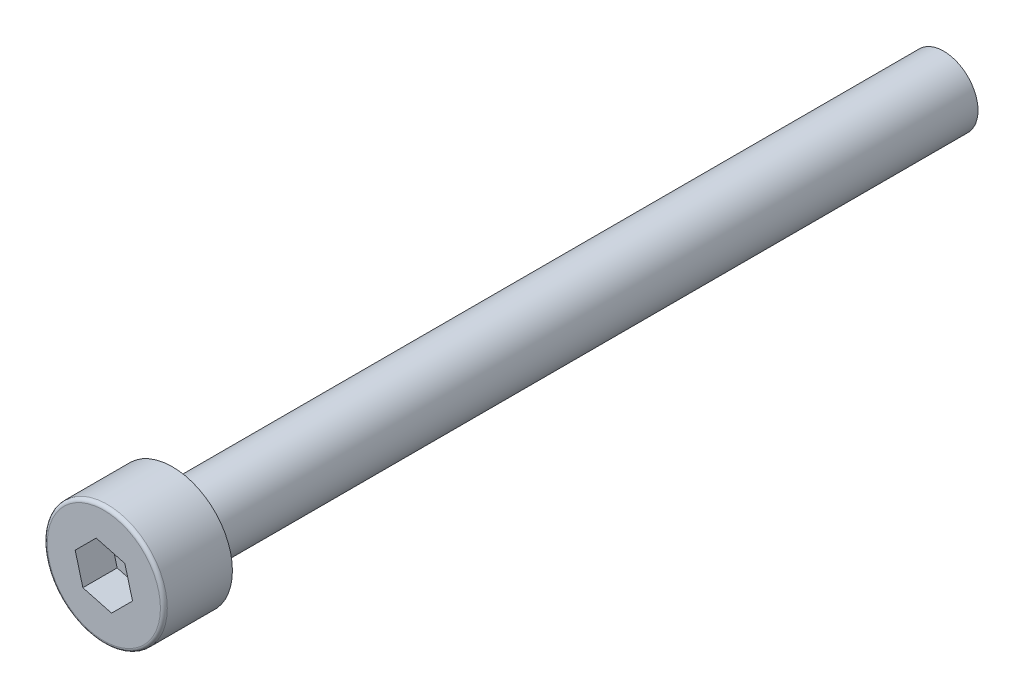
from build123d import *

# Parameters (mm, degrees)
SKETCH_1_R          = 3.5
EXTRUDE_1_DEPTH     = 4
CUT_EXTRUDE_1_DEPTH = 2
SKETCH_3_R          = 2
EXTRUDE_2_DEPTH     = 45
FILLET_1_R          = 0.2


with BuildPart() as part:
    # 草图1 → 凸台-拉伸1 (new body)
    with BuildSketch(Plane.XY):
        Circle(SKETCH_1_R)
    extrude(amount=EXTRUDE_1_DEPTH)

    # 草图2 → 切除-拉伸1 (cut)
    with BuildSketch(Plane.XY.offset(4)):
        Polygon((-1.224744871, -1.224744871), (0.448287736, -1.673032607), (1.673032607, -0.448287736), (1.224744871, 1.224744871), (-0.448287736, 1.673032607), (-1.673032607, 0.448287736), align=None)
    extrude(amount=-CUT_EXTRUDE_1_DEPTH, mode=Mode.SUBTRACT)

    # 草图3 → 凸台-拉伸2 (add)
    with BuildSketch(Plane(origin=(0, 0, 0), x_dir=(-1, 0, 0), z_dir=(0, 0, -1))):
        with Locations(Location((0, 0, 0), (0, 0, 180))):
            Circle(SKETCH_3_R)
    extrude(amount=EXTRUDE_2_DEPTH)

    # 圆角1
    fillet_1_edges = [part.edges().sort_by_distance(p)[0] for p in [
        (-3.5, 0, 4),
    ]]
    fillet(fillet_1_edges, radius=FILLET_1_R)


solid = part.part
